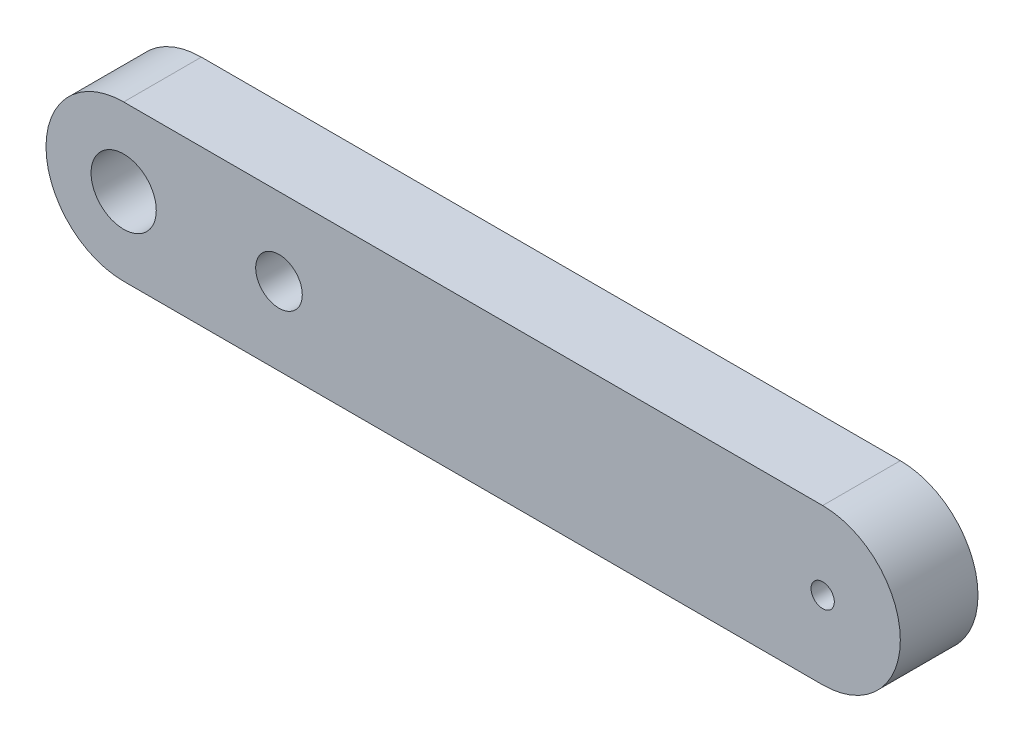
from build123d import *

# Parameters (mm, degrees)
SKETCH1_R           = 1.5
SKETCH1_R_2         = 0.75
BOSS_EXTRUDE1_DEPTH = 4
SKETCH2_R           = 1.25
CUT_EXTRUDE1_DEPTH  = 4
SKETCH3_R           = 1.5
CUT_EXTRUDE2_DEPTH  = 10
SKETCH4_R           = 1.5
SKETCH4_R_2         = 0.75
BOSS_EXTRUDE2_DEPTH = 1
SKETCH5_R           = 2.1
CUT_EXTRUDE3_DEPTH  = 10


with BuildPart() as part:
    # Sketch1 → Boss-Extrude1 (new body)
    with BuildSketch(Plane.XY):
        with BuildLine():
            Line((-81.517614561, 36.788472858), (-36.517614561, 36.788472858))
            ThreePointArc((-36.517614561, 36.788472858), (-31.517614561, 31.788472858), (-36.517614561, 26.788472858))
            Line((-36.517614561, 26.788472858), (-81.517614561, 26.788472858))
            ThreePointArc((-81.517614561, 26.788472858), (-86.517614561, 31.788472858), (-81.517614561, 36.788472858))
        make_face()
        with Locations((-81.517614561, 31.788472858)):
            Circle(SKETCH1_R, mode=Mode.SUBTRACT)
        with Locations((-36.517614561, 31.788472858)):
            Circle(SKETCH1_R_2, mode=Mode.SUBTRACT)
    extrude(amount=BOSS_EXTRUDE1_DEPTH)

    # Sketch2 → Cut-Extrude1 (cut)
    with BuildSketch(Plane.XY.offset(4)):
        with Locations((-71.517614561, 31.788472858)):
            Circle(SKETCH2_R)
    extrude(amount=-CUT_EXTRUDE1_DEPTH, mode=Mode.SUBTRACT)

    # Sketch3 → Cut-Extrude2 (cut)
    with BuildSketch(Plane.XY.offset(4)):
        with Locations((-71.517614561, 31.788472858)):
            Circle(SKETCH3_R)
    extrude(amount=-CUT_EXTRUDE2_DEPTH, mode=Mode.SUBTRACT)

    # Sketch4 → Boss-Extrude2 (add)
    with BuildSketch(Plane.XY.offset(4)):
        with BuildLine():
            Line((-81.517614561, 36.788472858), (-36.517614561, 36.788472858))
            ThreePointArc((-36.517614561, 36.788472858), (-31.517614561, 31.788472858), (-36.517614561, 26.788472858))
            Line((-36.517614561, 26.788472858), (-81.517614561, 26.788472858))
            ThreePointArc((-81.517614561, 26.788472858), (-86.517614561, 31.788472858), (-81.517614561, 36.788472858))
        make_face()
        with Locations((-81.517614561, 31.788472858)):
            Circle(SKETCH4_R, mode=Mode.SUBTRACT)
        with Locations((-71.517614561, 31.788472858)):
            Circle(SKETCH4_R, mode=Mode.SUBTRACT)
        with Locations((-36.517614561, 31.788472858)):
            Circle(SKETCH4_R_2, mode=Mode.SUBTRACT)
    extrude(amount=BOSS_EXTRUDE2_DEPTH)

    # Sketch5 → Cut-Extrude3 (cut)
    with BuildSketch(Plane.XY.offset(5)):
        with Locations((-81.517614561, 31.788472858)):
            Circle(SKETCH5_R)
    extrude(amount=-CUT_EXTRUDE3_DEPTH, mode=Mode.SUBTRACT)


solid = part.part
